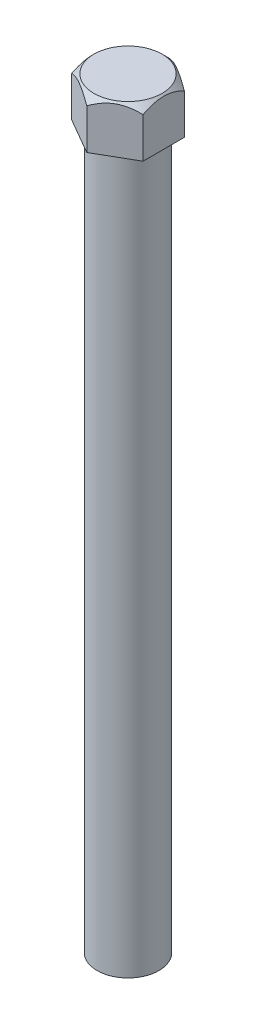
from build123d import *

# Parameters (mm, degrees)
SKETCH1_R           = 0.13
BOSS_EXTRUDE1_DEPTH = 3
SKETCH2_R           = 0.13
BOSS_EXTRUDE2_DEPTH = 0.2


with BuildPart() as part:
    # Sketch1 → Boss-Extrude1 (new body)
    with BuildSketch(Plane(origin=(0, 0, 0), x_dir=(1, 0, 0), z_dir=(0, 1, 0))):
        with Locations(Location((0, 0, 0), (0, 0, 270))):
            Circle(SKETCH1_R)
    extrude(amount=BOSS_EXTRUDE1_DEPTH)

    # Sketch2 → Boss-Extrude2 (add)
    with BuildSketch(Plane(origin=(0, 3, 0), x_dir=(1, 0, 0), z_dir=(0, 1, 0))):
        with Locations(Location((0, 0, 0), (0, 0, 270))):
            Circle(SKETCH2_R)
        Polygon((0.15, -0.08660254), (0.15, 0.08660254), (0, 0.173205081), (0, -0.173205081), align=None)
        with BuildLine():
            ThreePointArc((0.13, 0), (0.091923882, 0.091923882), (0, 0.13))
            Line((0, 0.13), (0, -0.13))
            ThreePointArc((0, -0.13), (0.091923882, -0.091923882), (0.13, 0))
        make_face()
        with BuildLine():
            Line((0, -0.13), (0, 0.13))
            ThreePointArc((0, 0.13), (-0.13, 0), (0, -0.13))
        make_face()
        Polygon((-0.15, 0.08660254), (-0.15, -0.08660254), (0, -0.173205081), (0, 0.173205081), align=None)
    extrude(amount=BOSS_EXTRUDE2_DEPTH)

    # Sketch4 → Cut-Revolve1 (revolve, cut)
    with BuildSketch(Plane(origin=(0, 0, 0), x_dir=(0, 0, -1), z_dir=(1, 0, 0)), mode=Mode.PRIVATE) as cut_revolve1_sk:
        Polygon((0.143205081, 3.2), (0.173205081, 3.2), (0.173205081, 3.17), align=None)
    revolve(cut_revolve1_sk.sketch.rotate(Axis((0, 3.2, 0), (0, -1, 0)), 3.7823e-05), axis=Axis((0, 3.2, 0), (0, -1, 0)), mode=Mode.SUBTRACT)


solid = part.part
